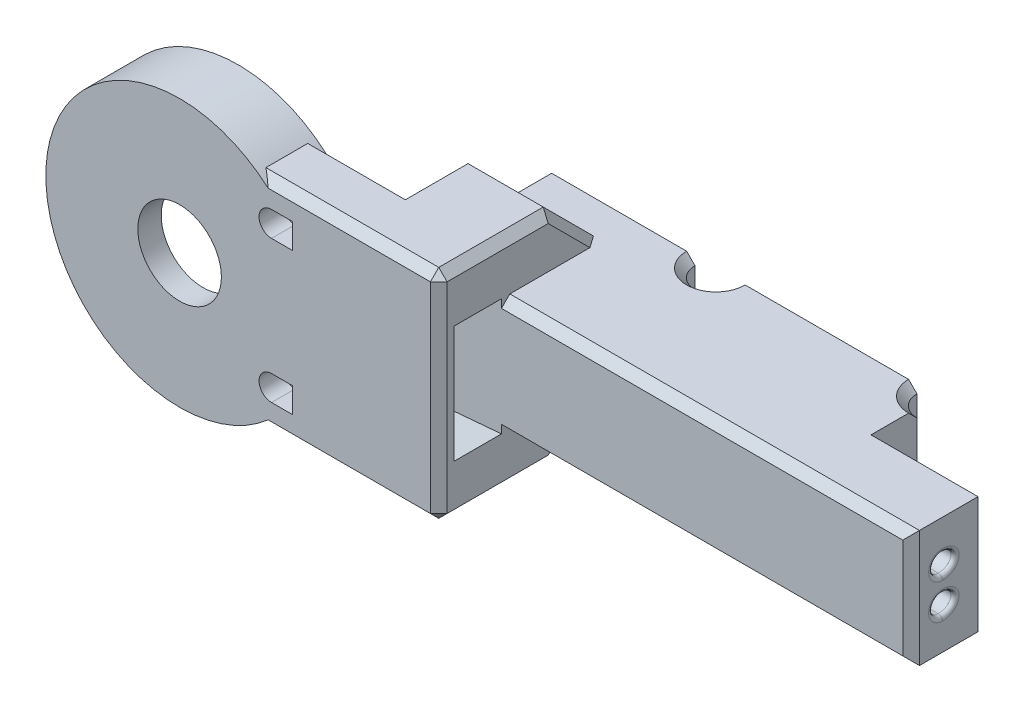
from build123d import *

# Parameters (mm, degrees)
SKETCH1_R            = 2.5
BOSS_EXTRUDE1_DEPTH  = 3.5
CUT_EXTRUDE17_DEPTH  = 2.1
BOSS_EXTRUDE11_DEPTH = 5
BOSS_EXTRUDE4_DEPTH  = 25
SKETCH7_W            = 8.9
SKETCH7_H            = 13
CUT_EXTRUDE2_DEPTH   = 4
SKETCH22_W           = 24.5
SKETCH22_H           = 13
CUT_EXTRUDE13_DEPTH  = 3.75
SKETCH23_W           = 24.5
SKETCH23_H           = 8
CUT_EXTRUDE14_DEPTH  = 3
CUT_EXTRUDE11_DEPTH  = 50.35648387
BOSS_EXTRUDE12_DEPTH = 7
SKETCH24_R           = 1.25
CUT_EXTRUDE15_DEPTH  = 43.430089673
SKETCH26_W           = 4.3
SKETCH26_H           = 4.75
CUT_EXTRUDE16_DEPTH  = 1.65
FILLET8_R            = 0.25
CHAMFER1_SIZE        = 0.5


with BuildPart() as part:
    # Sketch1 → Boss-Extrude1 (new body)
    with BuildSketch(Plane.XY):
        with BuildLine():
            ThreePointArc((4.663689527, 6.5), (-8, 0), (4.663689527, -6.5))
            Line((4.663689527, -6.5), (15, -6.5))
            Line((15, -6.5), (15, 6.5))
            Line((15, 6.5), (4.663689527, 6.5))
        make_face()
        with BuildLine():
            Line((5.5, 5), (6.75, 5))
            Line((6.75, 5), (6.75, 3.5))
            Line((6.75, 3.5), (5.5, 3.5))
            ThreePointArc((5.5, 3.5), (4.75, 4.25), (5.5, 5))
        make_face(mode=Mode.SUBTRACT)
        with BuildLine():
            Line((6.75, -3.5), (6.75, -5))
            Line((6.75, -5), (5.5, -5))
            ThreePointArc((5.5, -5), (4.75, -4.25), (5.5, -3.5))
            Line((5.5, -3.5), (6.75, -3.5))
        make_face(mode=Mode.SUBTRACT)
        Circle(SKETCH1_R, mode=Mode.SUBTRACT)
    extrude(amount=BOSS_EXTRUDE1_DEPTH)

    # Sketch39 → Cut-Extrude17 (cut)
    with BuildSketch(Plane(origin=(0, 0, 0), x_dir=(-1, 0, 0), z_dir=(0, 0, -1))):
        Polygon((5.75, 0.75), (5.75, 2.5), (2.5, 5.75), (-6.75, 5.75), (-6.75, -5.75), (2.5, -5.75), (5.75, -2.5), (5.75, -0.75), (8.376697216, -0.75), (8.376697216, 0.75), align=None)
    extrude(amount=-CUT_EXTRUDE17_DEPTH, mode=Mode.SUBTRACT)

    # Sketch38 → Boss-Extrude11 (add)
    with BuildSketch(Plane(origin=(15, 0, 0), x_dir=(0, 0, -1), z_dir=(1, 0, 0))):
        Polygon((-3.5, 6.5), (3.25, 6.5), (6.25, 3.5), (8.25, 3.5), (8.25, -3.5), (6.25, -3.5), (3.25, -6.5), (-3.5, -6.5), align=None)
    extrude(amount=-BOSS_EXTRUDE11_DEPTH)

    # Sketch6 → Boss-Extrude4 (add)
    with BuildSketch(Plane(origin=(15, 0, 0), x_dir=(0, 0, -1), z_dir=(1, 0, 0))):
        Polygon((6.25, 3.5), (3.25, 6.5), (-3.5, 6.5), (-3.5, -6.5), (3.25, -6.5), (6.25, -3.5), (8.25, -3.5), (8.25, 3.5), align=None)
    extrude(amount=BOSS_EXTRUDE4_DEPTH)

    # Sketch7 → Cut-Extrude2 (cut)
    with BuildSketch(Plane(origin=(0, 0, -8.25), x_dir=(-1, 0, 0), z_dir=(0, 0, -1))):
        with Locations((-35.55, 0)):
            Rectangle(SKETCH7_W, SKETCH7_H)
    extrude(amount=-CUT_EXTRUDE2_DEPTH, mode=Mode.SUBTRACT)

    # Sketch22 → Cut-Extrude13 (cut)
    with BuildSketch(Plane.XY.offset(3.5)):
        with Locations((27.75, 0)):
            Rectangle(SKETCH22_W, SKETCH22_H)
    extrude(amount=-CUT_EXTRUDE13_DEPTH, mode=Mode.SUBTRACT)

    # Sketch23 → Cut-Extrude14 (cut)
    with BuildSketch(Plane(origin=(0, 6.5, 0), x_dir=(1, 0, 0), z_dir=(0, 1, 0))):
        with Locations((27.75, 4.25)):
            Rectangle(SKETCH23_W, SKETCH23_H)
    cut_extrude14 = extrude(amount=-CUT_EXTRUDE14_DEPTH, mode=Mode.SUBTRACT)

    # Mirror1: Cut-Extrude14 across plane
    add(cut_extrude14.mirror(Plane.ZX), mode=Mode.SUBTRACT)

    # Sketch19 → Cut-Extrude11 (cut, through all)
    with BuildSketch(Plane(origin=(40, 0, 0), x_dir=(0, 0, -1), z_dir=(1, 0, 0))):
        with BuildLine():
            ThreePointArc((2.125, -0.475), (1.55, -1.05), (2.125, -1.625))
            add(Edge.make_bspline(
                [(2.125, -1.625), (2.875, -1.625), (2.875, -1.05), (2.875, -0.475), (2.125, -0.475)],
                knots=[4.71238898, 4.71238898, 4.71238898, 6.283185307, 6.283185307, 7.853981634, 7.853981634, 7.853981634], degree=2, weights=[1, 0.707106781, 1, 0.707106781, 1]))
        make_face()
        with BuildLine():
            ThreePointArc((2.125, 1.625), (1.55, 1.05), (2.125, 0.475))
            add(Edge.make_bspline(
                [(2.125, 0.475), (2.875, 0.475), (2.875, 1.05), (2.875, 1.625), (2.125, 1.625)],
                knots=[4.71238898, 4.71238898, 4.71238898, 6.283185307, 6.283185307, 7.853981634, 7.853981634, 7.853981634], degree=2, weights=[1, 0.707106781, 1, 0.707106781, 1]))
        make_face()
    extrude(amount=-CUT_EXTRUDE11_DEPTH, mode=Mode.SUBTRACT)

    # Sketch25 → Boss-Extrude12 (add)
    with BuildSketch(Plane(origin=(0, 3.5, 0), x_dir=(1, 0, 0), z_dir=(0, 1, 0))):
        with BuildLine():
            Line((31.1, 4.25), (33.6, 4.25))
            Line((33.6, 4.25), (33.6, 7))
            ThreePointArc((33.6, 7), (32.716116524, 7.366116524), (32.35, 8.25))
            Line((32.35, 8.25), (31.1, 8.25))
            Line((31.1, 8.25), (31.1, 4.25))
        make_face()
    extrude(amount=-BOSS_EXTRUDE12_DEPTH)

    # Sketch24 → Cut-Extrude15 (cut, through all)
    with BuildSketch(Plane(origin=(0, 3.5, 0), x_dir=(1, 0, 0), z_dir=(0, 1, 0))):
        with Locations((20.325, 8.25)):
            Circle(SKETCH24_R)
    extrude(amount=-CUT_EXTRUDE15_DEPTH, mode=Mode.SUBTRACT)

    # Sketch26 → Cut-Extrude16 (cut)
    with BuildSketch(Plane(origin=(0, -3.5, 0), x_dir=(1, 0, 0), z_dir=(0, 1, 0))):
        with Locations((26.75, 5.875)):
            Rectangle(SKETCH26_W, SKETCH26_H)
    extrude(amount=CUT_EXTRUDE16_DEPTH, mode=Mode.SUBTRACT)

    # Fillet8
    fillet8_edges = [part.edges().sort_by_distance(p)[0] for p in [
        (10, 1.05, -1.55),
        (10, 1.05, -2.875),
        (10, -1.05, -1.55),
        (10, -1.05, -2.875),
        (40, -1.05, -2.875),
        (40, -1.05, -1.55),
        (40, 1.05, -2.875),
        (40, 1.05, -1.55),
    ]]
    fillet(fillet8_edges, radius=FILLET8_R)

    # Sketch41 → Cut-Loft1 section 0
    with BuildSketch(Plane.ZY.offset(-6.75)):
        with BuildLine():
            Line((2.1, -4.25), (-0.25, -4.25))
            Line((-0.25, -4.25), (-0.25, 4.25))
            Line((-0.25, 4.25), (2.1, 4.25))
            Line((2.1, 4.25), (2.1, -4.25))
        make_face()
    # Sketch40 → Cut-Loft1 section 1
    with BuildSketch(Plane(origin=(15.5, 0, 0), x_dir=(0, 0, -1), z_dir=(1, 0, 0))):
        with BuildLine():
            Line((-2.1, 3.5), (0.25, 3.5))
            Line((0.25, 3.5), (0.25, -3.5))
            Line((0.25, -3.5), (-2.1, -3.5))
            Line((-2.1, -3.5), (-2.1, 3.5))
        make_face()
    loft(mode=Mode.SUBTRACT)

    # Chamfer1
    chamfer1_edges = [part.edges().sort_by_distance(p)[0] for p in [
        (10, 6.5, -1.625),
        (10, 5, -4.75),
        (10, 3.5, -7.25),
        (10, 0, -8.25),
        (10, -3.5, -7.25),
        (10, -5, -4.75),
        (10, -6.5, -1.625),
        (15.5, 0, 2.1),
        (15.5, -5, -4.75),
        (15.5, 5, -4.75),
        (15.5, 6.5, 0.125),
        (15.5, 0, 3.5),
        (15.5, -6.5, 0.125),
        (27.75, 3.5, -0.25),
        (40, 0, -0.25),
        (27.75, -3.5, -0.25),
        (24.6, -3.5, -5.875),
        (26.75, -3.5, -3.5),
        (28.9, -3.5, -5.875),
        (32.716116524, -3.5, -7.366116524),
        (32.716116524, 3.5, -7.366116524),
        (20.325, 3.5, -7),
        (20.325, -3.5, -7),
        (7.331844763, -6.5, 0),
        (7.331844763, 6.5, 0),
        (10.081844763, -6.5, 3.5),
        (10.081844763, 6.5, 3.5),
    ]]
    chamfer(chamfer1_edges, length=CHAMFER1_SIZE)


solid = part.part
